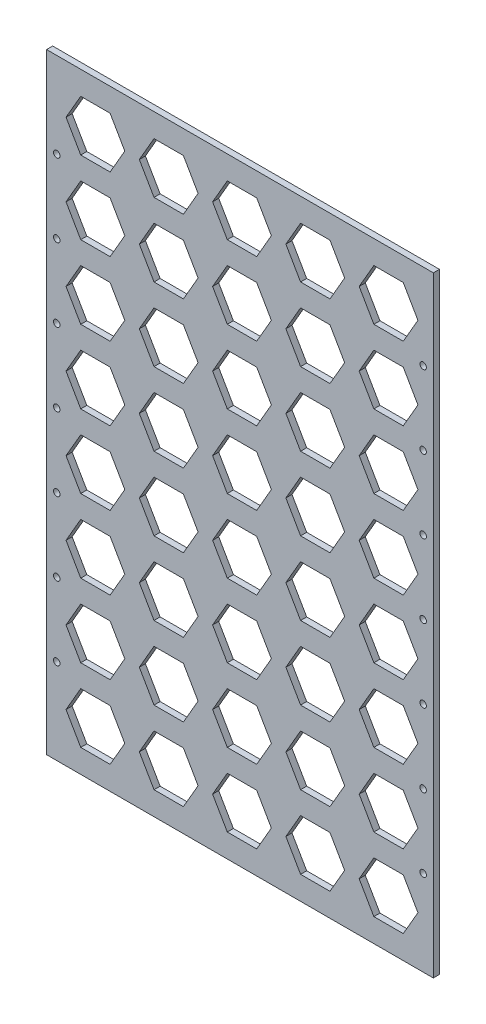
from build123d import *

# Parameters (mm, degrees)
SKETCH_1_W          = 190
SKETCH_1_H          = 300
EXTRUDE_1_DEPTH     = 3
CUT_EXTRUDE_1_DEPTH = 3
SKETCH_3_R          = 1.6
CUT_EXTRUDE_2_DEPTH = 10


with BuildPart() as part:
    # 草图1 → 凸台-拉伸1 (new body)
    with BuildSketch(Plane.XY):
        with Locations((95, -150)):
            Rectangle(SKETCH_1_W, SKETCH_1_H)
    extrude(amount=EXTRUDE_1_DEPTH)

    # 草图2 → 切除-拉伸1 (cut)
    with BuildSketch(Plane.XY.offset(3)):
        Polygon((38.43375673, -24), (31.216878365, -11.5), (16.783121635, -11.5), (9.56624327, -24), (16.783121635, -36.5), (31.216878365, -36.5), align=None)
        Polygon((67.216878365, -11.5), (52.783121635, -11.5), (45.56624327, -24), (52.783121635, -36.5), (67.216878365, -36.5), (74.43375673, -24), align=None)
        Polygon((103.216878365, -11.5), (88.783121635, -11.5), (81.56624327, -24), (88.783121635, -36.5), (103.216878365, -36.5), (110.43375673, -24), align=None)
        Polygon((139.216878365, -11.5), (124.783121635, -11.5), (117.56624327, -24), (124.783121635, -36.5), (139.216878365, -36.5), (146.43375673, -24), align=None)
        Polygon((175.216878365, -11.5), (160.783121635, -11.5), (153.56624327, -24), (160.783121635, -36.5), (175.216878365, -36.5), (182.43375673, -24), align=None)
        Polygon((67.216878365, -47.5), (52.783121635, -47.5), (45.56624327, -60), (52.783121635, -72.5), (67.216878365, -72.5), (74.43375673, -60), align=None)
        Polygon((103.216878365, -47.5), (88.783121635, -47.5), (81.56624327, -60), (88.783121635, -72.5), (103.216878365, -72.5), (110.43375673, -60), align=None)
        Polygon((139.216878365, -47.5), (124.783121635, -47.5), (117.56624327, -60), (124.783121635, -72.5), (139.216878365, -72.5), (146.43375673, -60), align=None)
        Polygon((175.216878365, -47.5), (160.783121635, -47.5), (153.56624327, -60), (160.783121635, -72.5), (175.216878365, -72.5), (182.43375673, -60), align=None)
        Polygon((67.216878365, -83.5), (52.783121635, -83.5), (45.56624327, -96), (52.783121635, -108.5), (67.216878365, -108.5), (74.43375673, -96), align=None)
        Polygon((103.216878365, -83.5), (88.783121635, -83.5), (81.56624327, -96), (88.783121635, -108.5), (103.216878365, -108.5), (110.43375673, -96), align=None)
        Polygon((139.216878365, -83.5), (124.783121635, -83.5), (117.56624327, -96), (124.783121635, -108.5), (139.216878365, -108.5), (146.43375673, -96), align=None)
        Polygon((175.216878365, -83.5), (160.783121635, -83.5), (153.56624327, -96), (160.783121635, -108.5), (175.216878365, -108.5), (182.43375673, -96), align=None)
        Polygon((67.216878365, -119.5), (52.783121635, -119.5), (45.56624327, -132), (52.783121635, -144.5), (67.216878365, -144.5), (74.43375673, -132), align=None)
        Polygon((103.216878365, -119.5), (88.783121635, -119.5), (81.56624327, -132), (88.783121635, -144.5), (103.216878365, -144.5), (110.43375673, -132), align=None)
        Polygon((139.216878365, -119.5), (124.783121635, -119.5), (117.56624327, -132), (124.783121635, -144.5), (139.216878365, -144.5), (146.43375673, -132), align=None)
        Polygon((175.216878365, -119.5), (160.783121635, -119.5), (153.56624327, -132), (160.783121635, -144.5), (175.216878365, -144.5), (182.43375673, -132), align=None)
        Polygon((67.216878365, -155.5), (52.783121635, -155.5), (45.56624327, -168), (52.783121635, -180.5), (67.216878365, -180.5), (74.43375673, -168), align=None)
        Polygon((103.216878365, -155.5), (88.783121635, -155.5), (81.56624327, -168), (88.783121635, -180.5), (103.216878365, -180.5), (110.43375673, -168), align=None)
        Polygon((139.216878365, -155.5), (124.783121635, -155.5), (117.56624327, -168), (124.783121635, -180.5), (139.216878365, -180.5), (146.43375673, -168), align=None)
        Polygon((175.216878365, -155.5), (160.783121635, -155.5), (153.56624327, -168), (160.783121635, -180.5), (175.216878365, -180.5), (182.43375673, -168), align=None)
        Polygon((67.216878365, -191.5), (52.783121635, -191.5), (45.56624327, -204), (52.783121635, -216.5), (67.216878365, -216.5), (74.43375673, -204), align=None)
        Polygon((103.216878365, -191.5), (88.783121635, -191.5), (81.56624327, -204), (88.783121635, -216.5), (103.216878365, -216.5), (110.43375673, -204), align=None)
        Polygon((139.216878365, -191.5), (124.783121635, -191.5), (117.56624327, -204), (124.783121635, -216.5), (139.216878365, -216.5), (146.43375673, -204), align=None)
        Polygon((175.216878365, -191.5), (160.783121635, -191.5), (153.56624327, -204), (160.783121635, -216.5), (175.216878365, -216.5), (182.43375673, -204), align=None)
        Polygon((67.216878365, -227.5), (52.783121635, -227.5), (45.56624327, -240), (52.783121635, -252.5), (67.216878365, -252.5), (74.43375673, -240), align=None)
        Polygon((103.216878365, -227.5), (88.783121635, -227.5), (81.56624327, -240), (88.783121635, -252.5), (103.216878365, -252.5), (110.43375673, -240), align=None)
        Polygon((139.216878365, -227.5), (124.783121635, -227.5), (117.56624327, -240), (124.783121635, -252.5), (139.216878365, -252.5), (146.43375673, -240), align=None)
        Polygon((175.216878365, -227.5), (160.783121635, -227.5), (153.56624327, -240), (160.783121635, -252.5), (175.216878365, -252.5), (182.43375673, -240), align=None)
        Polygon((67.216878365, -263.5), (52.783121635, -263.5), (45.56624327, -276), (52.783121635, -288.5), (67.216878365, -288.5), (74.43375673, -276), align=None)
        Polygon((103.216878365, -263.5), (88.783121635, -263.5), (81.56624327, -276), (88.783121635, -288.5), (103.216878365, -288.5), (110.43375673, -276), align=None)
        Polygon((139.216878365, -263.5), (124.783121635, -263.5), (117.56624327, -276), (124.783121635, -288.5), (139.216878365, -288.5), (146.43375673, -276), align=None)
        Polygon((175.216878365, -263.5), (160.783121635, -263.5), (153.56624327, -276), (160.783121635, -288.5), (175.216878365, -288.5), (182.43375673, -276), align=None)
        Polygon((31.216878365, -47.5), (16.783121635, -47.5), (9.56624327, -60), (16.783121635, -72.5), (31.216878365, -72.5), (38.43375673, -60), align=None)
        Polygon((31.216878365, -83.5), (16.783121635, -83.5), (9.56624327, -96), (16.783121635, -108.5), (31.216878365, -108.5), (38.43375673, -96), align=None)
        Polygon((31.216878365, -119.5), (16.783121635, -119.5), (9.56624327, -132), (16.783121635, -144.5), (31.216878365, -144.5), (38.43375673, -132), align=None)
        Polygon((31.216878365, -155.5), (16.783121635, -155.5), (9.56624327, -168), (16.783121635, -180.5), (31.216878365, -180.5), (38.43375673, -168), align=None)
        Polygon((31.216878365, -191.5), (16.783121635, -191.5), (9.56624327, -204), (16.783121635, -216.5), (31.216878365, -216.5), (38.43375673, -204), align=None)
        Polygon((31.216878365, -227.5), (16.783121635, -227.5), (9.56624327, -240), (16.783121635, -252.5), (31.216878365, -252.5), (38.43375673, -240), align=None)
        Polygon((31.216878365, -263.5), (16.783121635, -263.5), (9.56624327, -276), (16.783121635, -288.5), (31.216878365, -288.5), (38.43375673, -276), align=None)
    extrude(amount=-CUT_EXTRUDE_1_DEPTH, mode=Mode.SUBTRACT)

    # 草图3 → 切除-拉伸2 (cut)
    with BuildSketch(Plane.XY.offset(3)):
        with Locations((5, -42)):
            Circle(SKETCH_3_R)
        with Locations((185, -42)):
            Circle(SKETCH_3_R)
        with Locations((5, -78)):
            Circle(SKETCH_3_R)
        with Locations((185, -78)):
            Circle(SKETCH_3_R)
        with Locations((5, -114)):
            Circle(SKETCH_3_R)
        with Locations((185, -114)):
            Circle(SKETCH_3_R)
        with Locations((5, -150)):
            Circle(SKETCH_3_R)
        with Locations((185, -150)):
            Circle(SKETCH_3_R)
        with Locations((5, -186)):
            Circle(SKETCH_3_R)
        with Locations((185, -186)):
            Circle(SKETCH_3_R)
        with Locations((5, -222)):
            Circle(SKETCH_3_R)
        with Locations((185, -222)):
            Circle(SKETCH_3_R)
        with Locations((5, -258)):
            Circle(SKETCH_3_R)
        with Locations((185, -258)):
            Circle(SKETCH_3_R)
    extrude(amount=-CUT_EXTRUDE_2_DEPTH, mode=Mode.SUBTRACT)


solid = part.part
